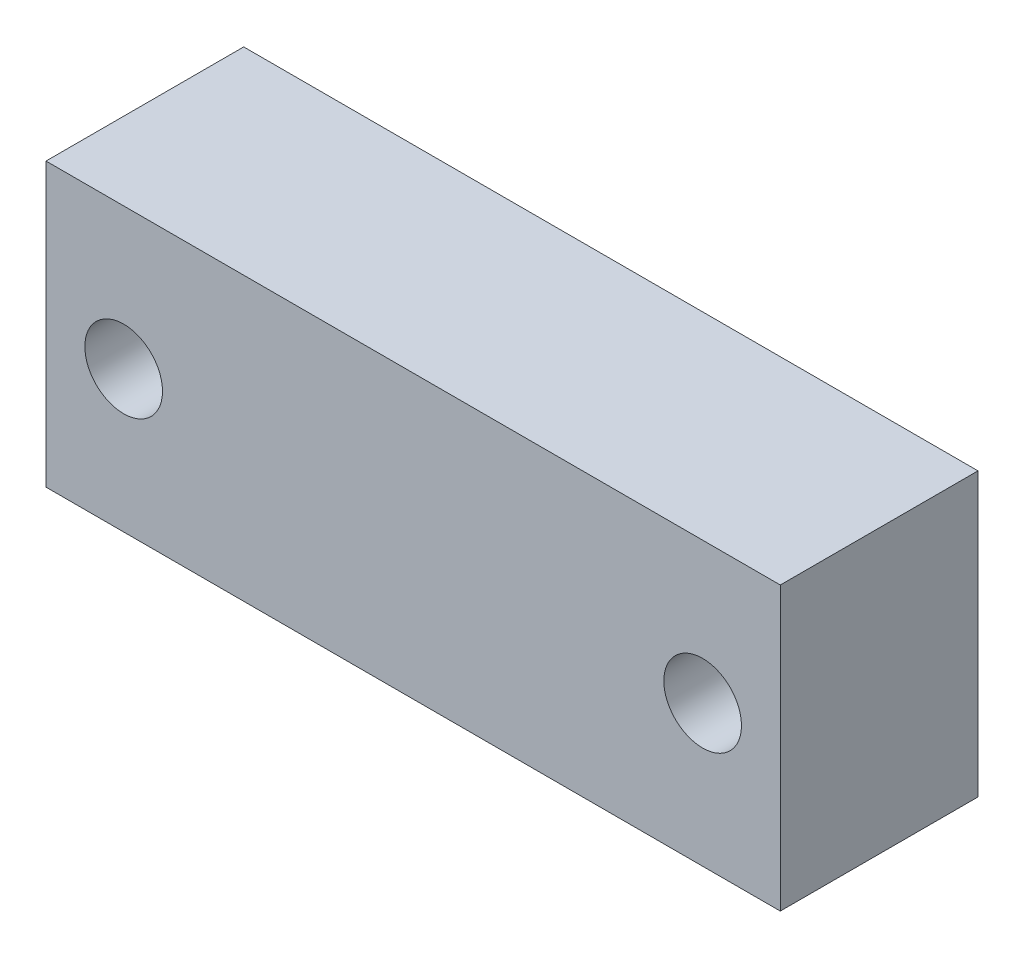
from build123d import *

# Parameters (mm, degrees)
SKETCH_1_W         = 52
SKETCH_1_H         = 20
EXTRUDE_1_DEPTH    = 14
HOLE_WIZARD_M5_1_D = 5.5


with BuildPart() as part:
    # 스케치1 → 보스-돌출1 (new body)
    with BuildSketch(Plane.XY):
        Rectangle(SKETCH_1_W, SKETCH_1_H)
    extrude(amount=EXTRUDE_1_DEPTH)

    # M5 여유 구멍1 (through all)
    with Locations(Plane.XY.offset(14)):
        with Locations((-20.5, 0), (20.5, 0)):
            Hole(HOLE_WIZARD_M5_1_D / 2)


solid = part.part
